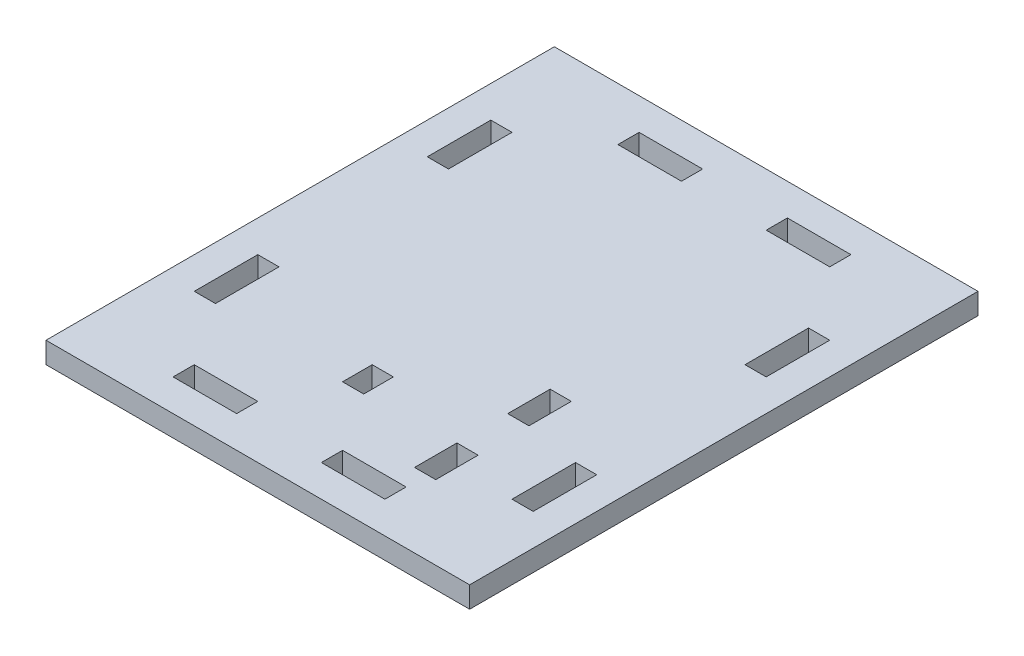
from build123d import *

# Parameters (mm, degrees)
SKETCH1_W         = 127
SKETCH1_H         = 152.4
SKETCH1_W_2       = 19.05
SKETCH1_H_2       = 6.35
SKETCH1_W_3       = 6.35
SKETCH1_H_3       = 19.05
BASE_DEPTH        = 6.35
SKETCH2_W         = 6.35
SKETCH2_H         = 12.7
SKETCH2_H_2       = 8.89
MOTORMOUNTS_DEPTH = 100.3932216


with BuildPart() as part:
    # Sketch1 → BASE (new body)
    with BuildSketch(Plane(origin=(0, 0, 0), x_dir=(1, 0, 0), z_dir=(0, 1, 0))):
        Rectangle(SKETCH1_W, SKETCH1_H)
        with Locations((-19.05, 63.5)):
            Rectangle(SKETCH1_W_2, SKETCH1_H_2, mode=Mode.SUBTRACT)
        with Locations((25.4, 63.5)):
            Rectangle(SKETCH1_W_2, SKETCH1_H_2, mode=Mode.SUBTRACT)
        with Locations((-50.8, 38.1)):
            Rectangle(SKETCH1_W_3, SKETCH1_H_3, mode=Mode.SUBTRACT)
        with Locations((-50.8, -31.75)):
            Rectangle(SKETCH1_W_3, SKETCH1_H_3, mode=Mode.SUBTRACT)
        with Locations((-25.4, -63.5)):
            Rectangle(SKETCH1_W_2, SKETCH1_H_2, mode=Mode.SUBTRACT)
        with Locations((19.05, -63.5)):
            Rectangle(SKETCH1_W_2, SKETCH1_H_2, mode=Mode.SUBTRACT)
        with Locations((50.8, -38.1)):
            Rectangle(SKETCH1_W_3, SKETCH1_H_3, mode=Mode.SUBTRACT)
        with Locations((50.8, 31.75)):
            Rectangle(SKETCH1_W_3, SKETCH1_H_3, mode=Mode.SUBTRACT)
    extrude(amount=BASE_DEPTH)

    # Sketch2 → MOTORMOUNTS (cut, through all)
    with BuildSketch(Plane(origin=(0, 6.35, 0), x_dir=(1, 0, 0), z_dir=(0, 1, 0))):
        with Locations((27.94, -19.685)):
            Rectangle(SKETCH2_W, SKETCH2_H)
        with Locations((27.94, -47.625)):
            Rectangle(SKETCH2_W, SKETCH2_H)
        with Locations((-5.08, -38.1)):
            Rectangle(SKETCH2_W, SKETCH2_H_2)
    extrude(amount=-MOTORMOUNTS_DEPTH, mode=Mode.SUBTRACT)


solid = part.part
